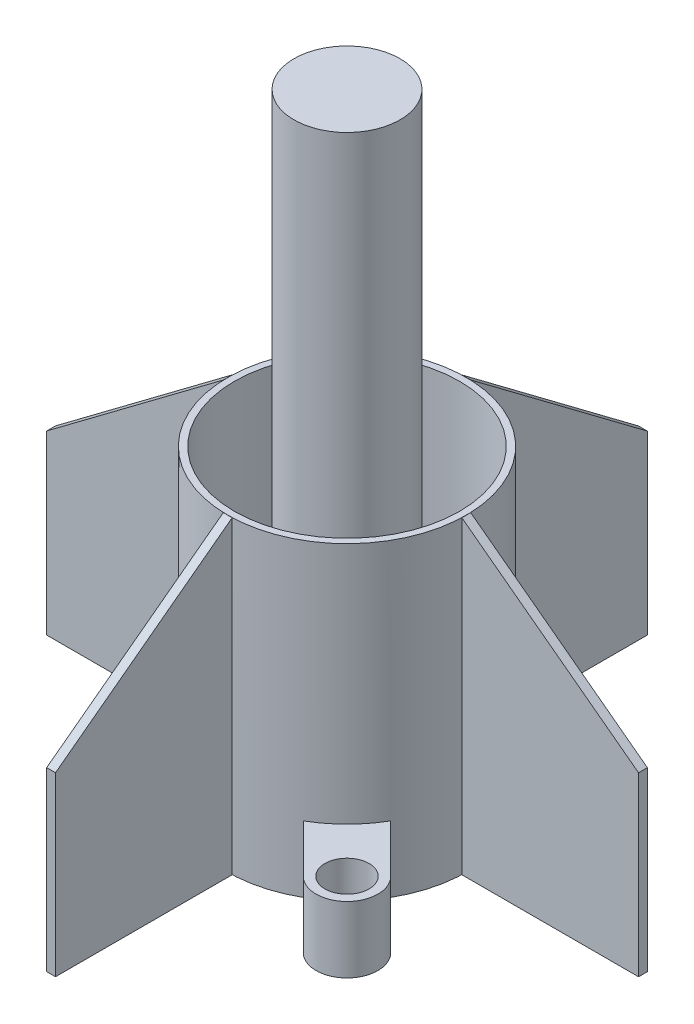
from build123d import *

# Parameters (mm, degrees)
SKETCH1_R             = 27
BOSS_EXTRUDE1_DEPTH   = 70
BOSS_EXTRUDE2_DEPTH   = 1
BOSS_EXTRUDE2_2_DEPTH = 1
BOSS_EXTRUDE3_DEPTH   = 1
BOSS_EXTRUDE3_2_DEPTH = 1
SKETCH4_R             = 25.5
CUT_EXTRUDE1_DEPTH    = 118.796537442
SKETCH9_R             = 27
BOSS_EXTRUDE6_DEPTH   = 4
SKETCH10_R            = 12
BOSS_EXTRUDE7_DEPTH   = 140
SKETCH11_R            = 10.5
CUT_EXTRUDE3_DEPTH    = 125
FILLET1_R             = 10
BOSS_EXTRUDE8_DEPTH   = 15
SKETCH14_R            = 5
CUT_EXTRUDE4_DEPTH    = 15


with BuildPart() as part:
    # Sketch1 → Boss-Extrude1 (new body)
    with BuildSketch(Plane(origin=(0, 0, 0), x_dir=(1, 0, 0), z_dir=(0, 1, 0))):
        with Locations(Location((0, 0, 0), (0, 0, 270))):
            Circle(SKETCH1_R)
    extrude(amount=BOSS_EXTRUDE1_DEPTH)

    # Sketch4 → Cut-Extrude1 (cut, through all)
    with BuildSketch(Plane(origin=(0, 0, 0), x_dir=(-1, 0, 0), z_dir=(0, -1, 0))):
        with Locations(Location((0, 0, 0), (0, 0, 90))):
            Circle(SKETCH4_R)
    extrude(amount=-CUT_EXTRUDE1_DEPTH, mode=Mode.SUBTRACT)

    # Sketch9 → Boss-Extrude6 (add)
    with BuildSketch(Plane.XZ):
        with Locations(Location((0, 0, 0), (0, 0, 90))):
            Circle(SKETCH9_R)
    extrude(amount=-BOSS_EXTRUDE6_DEPTH)

    # Sketch10 → Boss-Extrude7 (add)
    with BuildSketch(Plane.XZ):
        with Locations(Location((0, 0, 0), (0, 0, 270))):
            Circle(SKETCH10_R)
    extrude(amount=-BOSS_EXTRUDE7_DEPTH)

    # Sketch11 → Cut-Extrude3 (cut)
    with BuildSketch(Plane.XZ):
        with Locations(Location((0, 0, 0), (0, 0, 270))):
            Circle(SKETCH11_R)
    extrude(amount=-CUT_EXTRUDE3_DEPTH, mode=Mode.SUBTRACT)

    # Fillet1
    fillet1_edges = [part.edges().sort_by_distance(p)[0] for p in [
        (0, 4, 12),
    ]]
    fillet(fillet1_edges, radius=FILLET1_R)

    # Sketch13 → Boss-Extrude8 (add)
    with BuildSketch(Plane.XZ):
        with BuildLine():
            Line((13.489341446, 23.388836383), (24.33335346, 34.232848397))
            ThreePointArc((24.33335346, 34.232848397), (34.232848397, 34.232848397), (34.232848397, 24.33335346))
            Line((34.232848397, 24.33335346), (23.388836383, 13.489341446))
            Line((23.388836383, 13.489341446), (13.489341446, 23.388836383))
        make_face()
        with BuildLine():
            Line((-23.388836383, -13.489341446), (-34.232848397, -24.33335346))
            ThreePointArc((-34.232848397, -24.33335346), (-34.232848397, -34.232848397), (-24.33335346, -34.232848397))
            Line((-24.33335346, -34.232848397), (-13.489341446, -23.388836383))
            Line((-13.489341446, -23.388836383), (-23.388836383, -13.489341446))
        make_face()
    extrude(amount=-BOSS_EXTRUDE8_DEPTH)

    # Sketch14 → Cut-Extrude4 (cut)
    with BuildSketch(Plane.XZ):
        with Locations(Location((29.283100929, 29.283100929, 0), (0, 0, 270))):
            Circle(SKETCH14_R)
        with Locations(Location((-29.283100929, -29.283100929, 0), (0, 0, 90))):
            Circle(SKETCH14_R)
    extrude(amount=-CUT_EXTRUDE4_DEPTH, mode=Mode.SUBTRACT)


with BuildPart() as body_2:
    # Sketch2 → Boss-Extrude2 (new, symmetric)
    with BuildSketch(Plane.XY):
        Polygon((27, 70), (67, 40), (67, 0), (27, 0), align=None)
    extrude(amount=BOSS_EXTRUDE2_DEPTH, both=True)


with BuildPart() as body_3:
    # Sketch2 → Boss-Extrude2 2 (new, symmetric)
    with BuildSketch(Plane.XY):
        Polygon((-67, 0), (-27, 0), (-27, 70), (-67, 40), align=None)
    extrude(amount=BOSS_EXTRUDE2_2_DEPTH, both=True)


with BuildPart() as body_4:
    # Sketch3 → Boss-Extrude3 (new, symmetric)
    with BuildSketch(Plane(origin=(0, 0, 0), x_dir=(0, 0, -1), z_dir=(1, 0, 0))):
        Polygon((-27, 70), (-66.985253851, 40), (-66.985253851, 0), (-27, 0), align=None)
    extrude(amount=BOSS_EXTRUDE3_DEPTH, both=True)


with BuildPart() as body_5:
    # Sketch3 → Boss-Extrude3 2 (new, symmetric)
    with BuildSketch(Plane(origin=(0, 0, 0), x_dir=(0, 0, -1), z_dir=(1, 0, 0))):
        Polygon((27, 0), (27, 70), (66.985253851, 40), (66.985253851, 0), align=None)
    extrude(amount=BOSS_EXTRUDE3_2_DEPTH, both=True)


solid = Compound([part.part, body_2.part, body_3.part, body_4.part, body_5.part])
